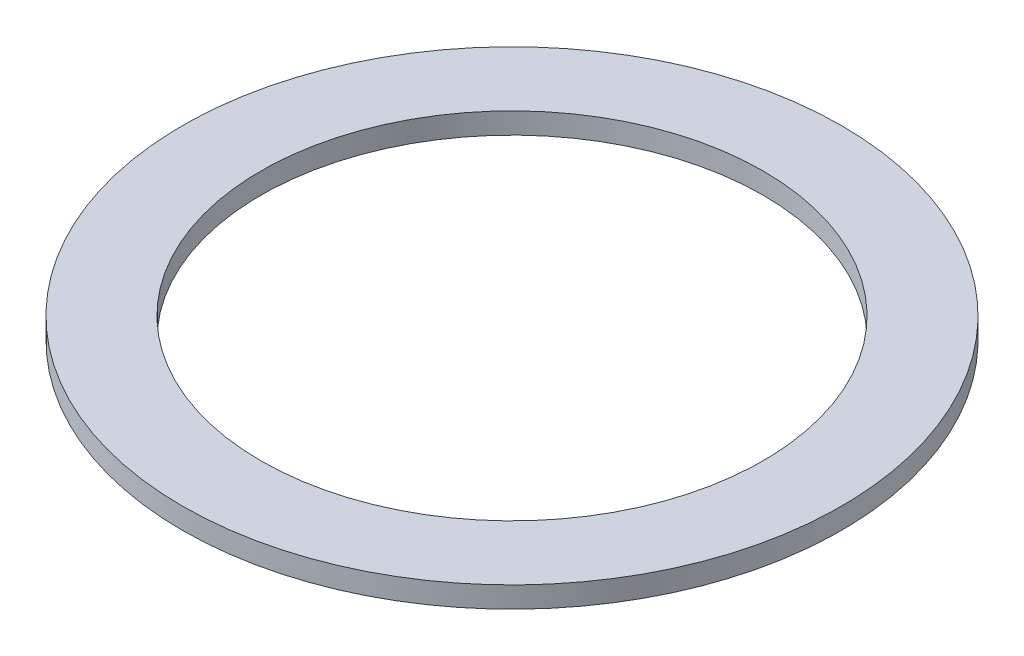
from build123d import *

# Parameters (mm, degrees)
SKETCH1_R           = 105
SKETCH1_R_2         = 80
BOSS_EXTRUDE1_DEPTH = 6.7


with BuildPart() as part:
    # Sketch1 → Boss-Extrude1 (new body)
    with BuildSketch(Plane(origin=(0, 0, 0), x_dir=(1, 0, 0), z_dir=(0, 1, 0))):
        with Locations(Location((0, 0, 0), (0, 0, 270))):
            Circle(SKETCH1_R)
        with Locations(Location((0, 0, 0), (0, 0, 270))):
            Circle(SKETCH1_R_2, mode=Mode.SUBTRACT)
    extrude(amount=BOSS_EXTRUDE1_DEPTH)


solid = part.part
